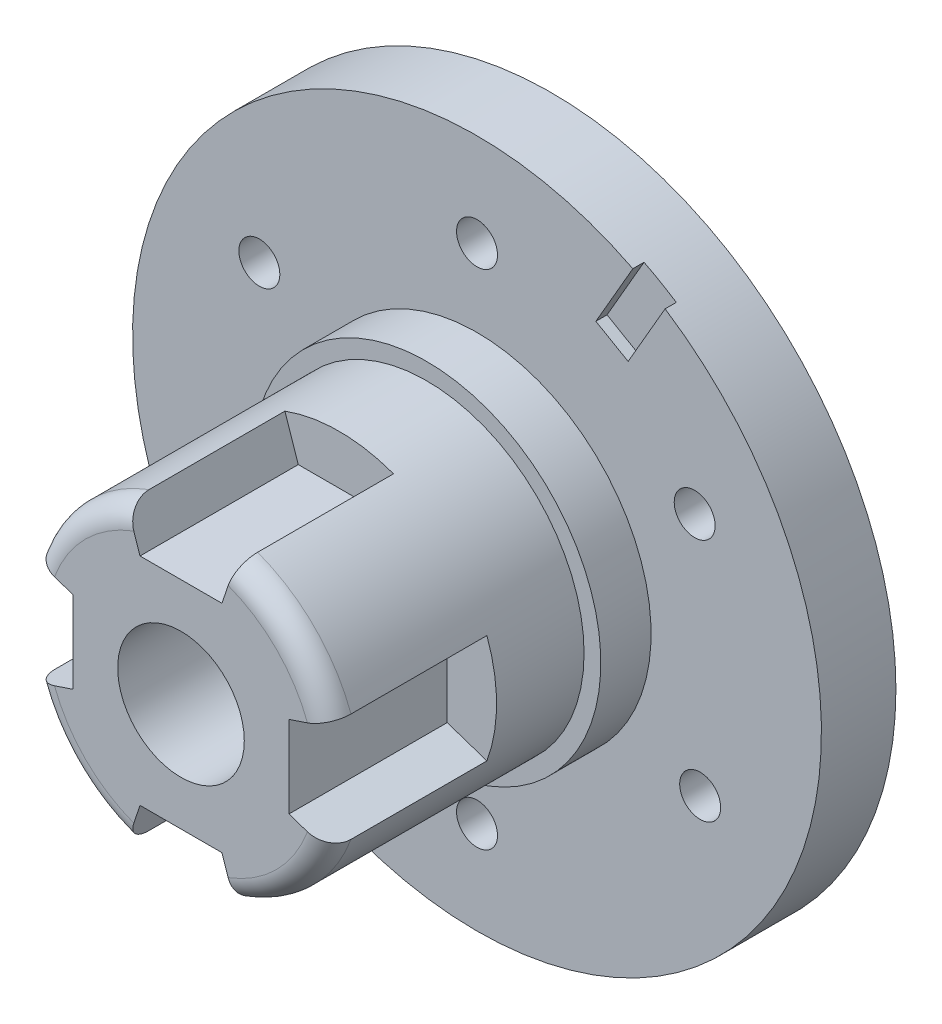
from build123d import *

# Parameters (mm, degrees)
SKETCH_1_R          = 18.5
SKETCH_1_R_2        = 1.1
EXTRUDE_1_DEPTH     = 4
SKETCH_3_R          = 8.45
EXTRUDE_3_DEPTH     = 15.9
FILLET_1_R          = 1.2
CUT_EXTRUDE_1_DEPTH = 8.5
SKETCH_5_R          = 9.35
EXTRUDE_4_DEPTH     = 2.7
SKETCH_6_R          = 1.1
CUT_EXTRUDE_2_DEPTH = 33.871111998
SKETCH_7_R          = 3.4
CUT_EXTRUDE_3_DEPTH = 6.5
CUT_EXTRUDE_START   = 4
CUT_EXTRUDE_5_DEPTH = 0.6


with BuildPart() as part:
    # Эскиз1 → Бобышка-Вытянуть1 (new body)
    with BuildSketch(Plane.XY):
        Circle(SKETCH_1_R)
        with Locations((0, 13.5)):
            Circle(SKETCH_1_R_2, mode=Mode.SUBTRACT)
        with Locations((-11.985507699, -6.212697095)):
            Circle(SKETCH_1_R_2, mode=Mode.SUBTRACT)
        with Locations((11.985507699, -6.212697095)):
            Circle(SKETCH_1_R_2, mode=Mode.SUBTRACT)
    extrude(amount=EXTRUDE_1_DEPTH)

    # Эскиз3 → Бобышка-Вытянуть3 (add)
    with BuildSketch(Plane.XY.offset(4)):
        Circle(SKETCH_3_R)
    extrude(amount=EXTRUDE_3_DEPTH)

    # Скругление1
    fillet_1_edges = [part.edges().sort_by_distance(p)[0] for p in [
        (-8.45, 0, 19.9),
    ]]
    fillet(fillet_1_edges, radius=FILLET_1_R)

    # Эскиз4 → Вырез-Вытянуть1 (cut)
    with BuildSketch(Plane.XY.offset(19.9)):
        with BuildLine():
            Line((-2.2, 5.799999981), (-2.931860794, 7.978357743))
            ThreePointArc((-2.931860794, 7.978357743), (-6.37e-07, 8.5), (2.931859599, 7.978358183))
            Line((2.931859599, 7.978358183), (2.2, 5.800000019))
            Line((2.2, 5.800000019), (-2.2, 5.799999981))
        make_face()
        with BuildLine():
            Line((5.799999981, 2.2), (7.978357743, 2.931860794))
            ThreePointArc((7.978357743, 2.931860794), (8.5, 6.37e-07), (7.978358183, -2.931859599))
            Line((7.978358183, -2.931859599), (5.800000019, -2.2))
            Line((5.800000019, -2.2), (5.799999981, 2.2))
        make_face()
        with BuildLine():
            Line((2.2, -5.799999981), (2.931860794, -7.978357743))
            ThreePointArc((2.931860794, -7.978357743), (6.37e-07, -8.5), (-2.931859599, -7.978358183))
            Line((-2.931859599, -7.978358183), (-2.2, -5.800000019))
            Line((-2.2, -5.800000019), (2.2, -5.799999981))
        make_face()
        with BuildLine():
            Line((-5.799999981, -2.2), (-7.978357743, -2.931860794))
            ThreePointArc((-7.978357743, -2.931860794), (-8.5, -6.37e-07), (-7.978358183, 2.931859599))
            Line((-7.978358183, 2.931859599), (-5.800000019, 2.2))
            Line((-5.800000019, 2.2), (-5.799999981, -2.2))
        make_face()
    extrude(amount=-CUT_EXTRUDE_1_DEPTH, mode=Mode.SUBTRACT)

    # Эскиз5 → Бобышка-Вытянуть4 (add)
    with BuildSketch(Plane.XY.offset(4)):
        with Locations(Location((0, 0, 0), (0, 0, 180))):
            Circle(SKETCH_5_R)
    extrude(amount=EXTRUDE_4_DEPTH)

    # Эскиз6 → Вырез-Вытянуть2 (cut, through all)
    with BuildSketch(Plane(origin=(0, 0, 0), x_dir=(-1, 0, 0), z_dir=(0, 0, -1))):
        with Locations((-11.691342951, 6.75)):
            Circle(SKETCH_6_R)
        with Locations((11.691342951, 6.75)):
            Circle(SKETCH_6_R)
        with Locations((0, -13.5)):
            Circle(SKETCH_6_R)
    extrude(amount=-CUT_EXTRUDE_2_DEPTH, mode=Mode.SUBTRACT)

    # Эскиз7 → Вырез-Вытянуть3 (cut)
    with BuildSketch(Plane.XY.offset(19.9)):
        Circle(SKETCH_7_R)
    extrude(amount=-CUT_EXTRUDE_3_DEPTH, mode=Mode.SUBTRACT)

    # Эскиз8 → Вырез-Вытянуть5 (cut)
    with BuildSketch(Plane.XY.offset(CUT_EXTRUDE_START)):
        Polygon((8.116025404, 12.057368355), (10.116025404, 15.52146997), (8.383974596, 16.52146997), (6.383974596, 13.057368355), align=None)
    extrude(amount=-CUT_EXTRUDE_5_DEPTH, mode=Mode.SUBTRACT)


solid = part.part
